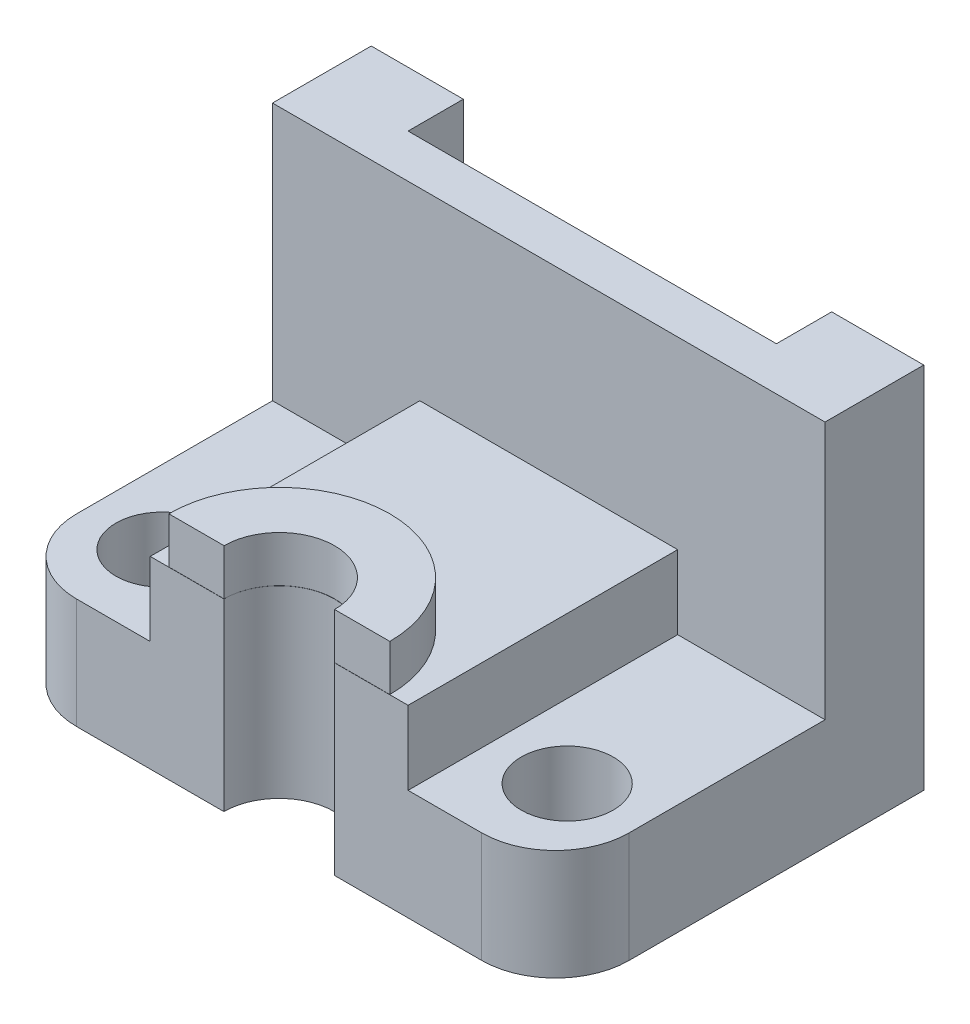
from build123d import *

# Parameters (mm, degrees)
SKETCH_1_W               = 60
SKETCH_1_H               = 40
EXTRUDE_1_DEPTH          = 40
SKETCH_2_W               = 40
SKETCH_2_H               = 6
CUT_EXTRUDE_1_DEPTH      = 83.462112512
CUT_EXTRUDE_2_DEPTH      = 76.498344353
CUT_EXTRUDE_2_DEPTH_BACK = 76.498344353
SKETCH_6_W               = 29.277204284
SKETCH_6_H               = 28
EXTRUDE_2_REACH          = 84.462
SKETCH_7_W               = 28
SKETCH_7_H               = 8
EXTRUDE_4_DEPTH          = 5
SKETCH_12_R              = 5
CUT_EXTRUDE_4_DEPTH      = 78.356318423
FILLET_1_R               = 8
SKETCH_14_R              = 6
CUT_EXTRUDE_5_DEPTH      = 75.833147735


with BuildPart() as part:
    # 草图1 → 凸台-拉伸1 (new body)
    with BuildSketch(Plane(origin=(0, 0, 0), x_dir=(1, 0, 0), z_dir=(0, 1, 0))):
        with Locations((30, -20)):
            Rectangle(SKETCH_1_W, SKETCH_1_H)
    extrude(amount=EXTRUDE_1_DEPTH)

    # 草图2 → 切除-拉伸1 (cut, through all)
    with BuildSketch(Plane(origin=(0, 40, 0), x_dir=(1, 0, 0), z_dir=(0, 1, 0))):
        with Locations((30, -3)):
            Rectangle(SKETCH_2_W, SKETCH_2_H)
    extrude(amount=-CUT_EXTRUDE_1_DEPTH, mode=Mode.SUBTRACT)

    # 草图6 → 切除-拉伸2 (cut, two sides: drawn at the far end of the back side and taken through both)
    with BuildSketch(Plane.ZY.offset(-50).offset(-CUT_EXTRUDE_2_DEPTH_BACK)):
        with Locations((25.361397858, 26)):
            Rectangle(SKETCH_6_W, SKETCH_6_H)
    extrude(amount=CUT_EXTRUDE_2_DEPTH + CUT_EXTRUDE_2_DEPTH_BACK, mode=Mode.SUBTRACT)

    # 草图7 → 凸台-拉伸2 (add, up to next)
    with BuildSketch(Plane.XY.offset(40), mode=Mode.PRIVATE) as extrude_2_sk1:
        with Locations((30, 16)):
            Rectangle(SKETCH_7_W, SKETCH_7_H)
    extrude_2_tool1 = extrude(extrude_2_sk1.sketch, amount=-EXTRUDE_2_REACH, mode=Mode.PRIVATE) - part.part
    add(extrude_2_tool1.solids().sort_by_distance((30, 16, 40))[0])

    # 草图8 → 凸台-拉伸4 (add)
    with BuildSketch(Plane(origin=(0, 20, 0), x_dir=(1, 0, 0), z_dir=(0, 1, 0))):
        with BuildLine():
            ThreePointArc((24, -39.980933727), (30, -33.980933727), (36, -39.980933727))
            Line((36, -39.980933727), (42, -39.980933727))
            ThreePointArc((42, -39.980933727), (30, -27.980933727), (18, -39.980933727))
            Line((18, -39.980933727), (24, -39.980933727))
        make_face()
    extrude(amount=EXTRUDE_4_DEPTH)

    # 草图12 → 切除-拉伸4 (cut, through all)
    with BuildSketch(Plane(origin=(0, 12, 0), x_dir=(1, 0, 0), z_dir=(0, 1, 0))):
        with Locations(Location((8, -30.722795716, 0), (0, 0, 270))):
            Circle(SKETCH_12_R)
        with Locations(Location((52, -30.722795716, 0), (0, 0, 270))):
            Circle(SKETCH_12_R)
    extrude(amount=-CUT_EXTRUDE_4_DEPTH, mode=Mode.SUBTRACT)

    # 圆角1
    fillet_1_edges = [part.edges().sort_by_distance(p)[0] for p in [
        (60, 6, 40),
        (0, 6, 40),
    ]]
    fillet(fillet_1_edges, radius=FILLET_1_R)

    # 草图14 → 切除-拉伸5 (cut, through all)
    with BuildSketch(Plane(origin=(0, 20, 0), x_dir=(1, 0, 0), z_dir=(0, 1, 0))):
        with Locations((30, -40)):
            Circle(SKETCH_14_R)
    extrude(amount=-CUT_EXTRUDE_5_DEPTH, mode=Mode.SUBTRACT)


solid = part.part
